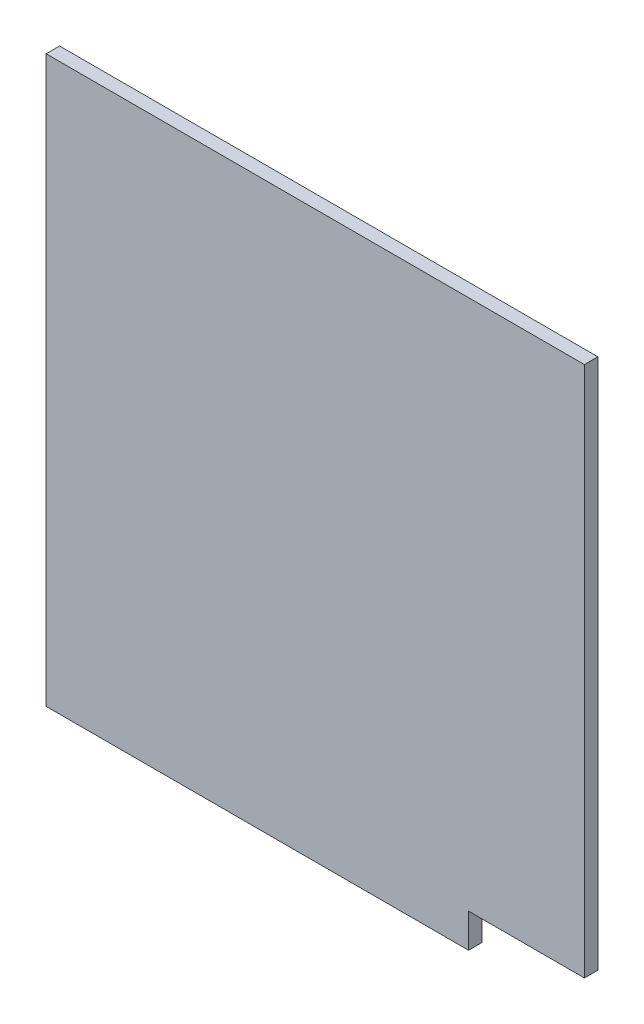
from build123d import *

# Parameters (mm, degrees)
BOSS_EXTRUDE1_DEPTH = 4.7625


with BuildPart() as part:
    # Sketch1 → Boss-Extrude1 (new body)
    with BuildSketch(Plane.XY):
        Polygon((195.2375, 0), (4.7625, 0), (4.7625, -200), (154.2375, -200), (154.2375, -188), (195.2375, -188), align=None)
    extrude(amount=-BOSS_EXTRUDE1_DEPTH)


solid = part.part
